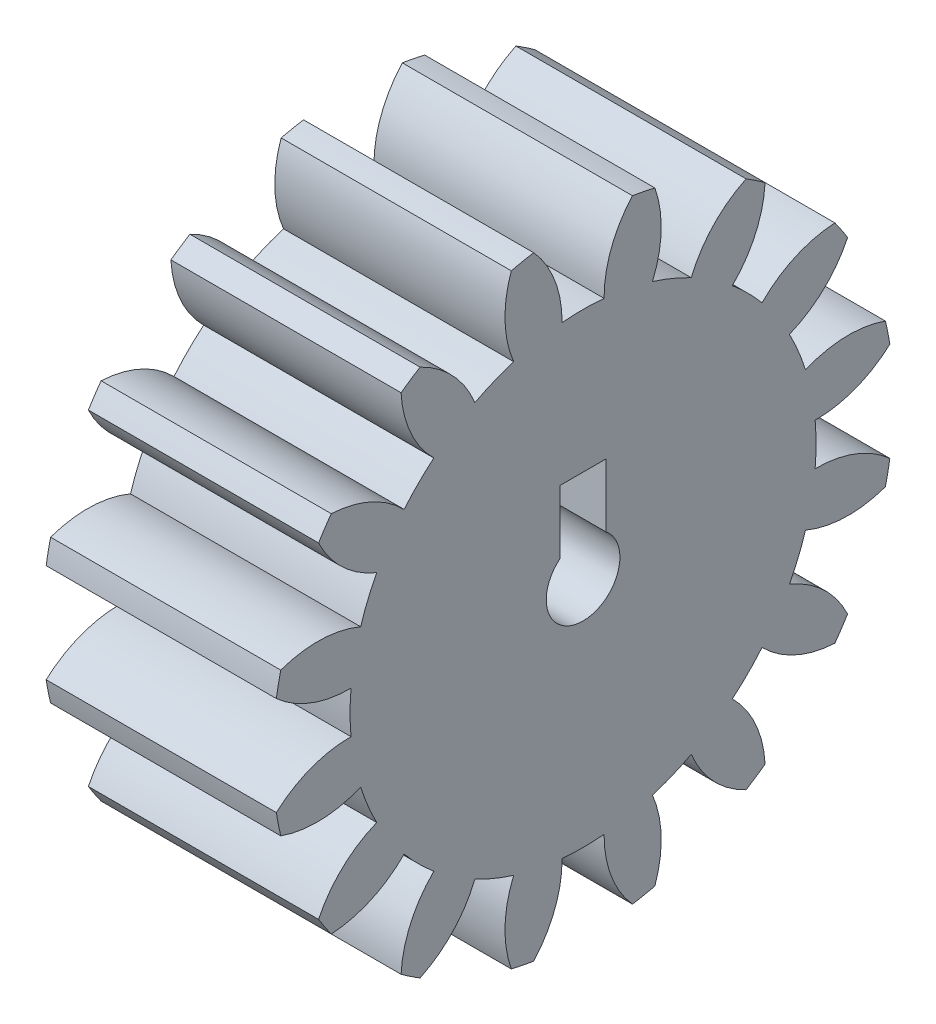
from build123d import *

# Parameters (mm, degrees)
BASPROSKE_W         = 10
BASPROSKE_H         = 13.5
TOOTHCUT_DEPTH      = 22.552262062
TEETHCUTS_COUNT     = 16
TEETHCUTS_ANGLE     = 337.5
BORSKE_R            = 3
BORE_DEPTH          = 50.0000508
KEYSKE_W            = 2
KEYSKE_H            = 4
KEYWAY_DEPTH        = 50.0000508
SKETCH1_R           = 5.698738584
BOSS_EXTRUDE1_DEPTH = 10


with BuildPart() as part:
    # BasProSke → Base-Revolve (revolve)
    with BuildSketch(Plane(origin=(0, 0, 0), x_dir=(1, 0, 0), z_dir=(0, 1, 0)), mode=Mode.PRIVATE) as base_revolve_sk:
        with Locations((5, 6.75)):
            Rectangle(BASPROSKE_W, BASPROSKE_H)
    revolve(base_revolve_sk.sketch.rotate(Axis((-10, 0, 0), (1, 0, 0)), 180), axis=Axis((-10, 0, 0), (1, 0, 0)))

    # TooCutSke → ToothCut (cut, through all)
    with BuildSketch(Plane(origin=(0, 0, 0), x_dir=(0, 0, -1), z_dir=(1, 0, 0))):
        with BuildLine():
            ThreePointArc((0.91215808, 10.08282419), (0, 10.124), (-0.91215808, 10.08282419))
            ThreePointArc((-0.91215808, 10.08282419), (-1.23025345, 11.835184302), (-2.165362868, 13.35094187))
            ThreePointArc((-2.165362868, 13.35094187), (0, 13.5254), (2.165362868, 13.35094187))
            ThreePointArc((2.165362868, 13.35094187), (1.23025345, 11.835184302), (0.91215808, 10.08282419))
        make_face()
    toothcut = extrude(amount=TOOTHCUT_DEPTH, mode=Mode.SUBTRACT)

    # TeethCuts: ToothCut ×16 about axis
    teethcuts_axis = Axis((-10, 0, 0), (1, 0, 0))
    for i in range(1, TEETHCUTS_COUNT):
        add(toothcut.rotate(teethcuts_axis, i * TEETHCUTS_ANGLE / (TEETHCUTS_COUNT - 1)), mode=Mode.SUBTRACT)

    # BorSke → Bore (cut, symmetric)
    with BuildSketch(Plane(origin=(0, 0, 0), x_dir=(0, 0, -1), z_dir=(1, 0, 0))):
        with Locations(Location((0, 0, 0), (0, 0, 180))):
            Circle(BORSKE_R)
    extrude(amount=BORE_DEPTH, both=True, mode=Mode.SUBTRACT)

    # KeySke → Keyway (cut, symmetric)
    with BuildSketch(Plane(origin=(0, 0, 0), x_dir=(0, 0, -1), z_dir=(1, 0, 0))):
        with Locations((0, 2)):
            Rectangle(KEYSKE_W, KEYSKE_H)
    extrude(amount=KEYWAY_DEPTH, both=True, mode=Mode.SUBTRACT)

    # Sketch1 → Boss-Extrude1 (add, through all)
    with BuildSketch(Plane(origin=(10, 0, 0), x_dir=(0, 0, -1), z_dir=(1, 0, 0))):
        Circle(SKETCH1_R)
        with BuildLine():
            Line((-1, 4), (-1, 1.2489996))
            ThreePointArc((-1, 1.2489996), (0, -1.6), (1, 1.2489996))
            Line((1, 1.2489996), (1, 4))
            Line((1, 4), (-1, 4))
        make_face(mode=Mode.SUBTRACT)
    extrude(amount=-BOSS_EXTRUDE1_DEPTH)


solid = part.part
